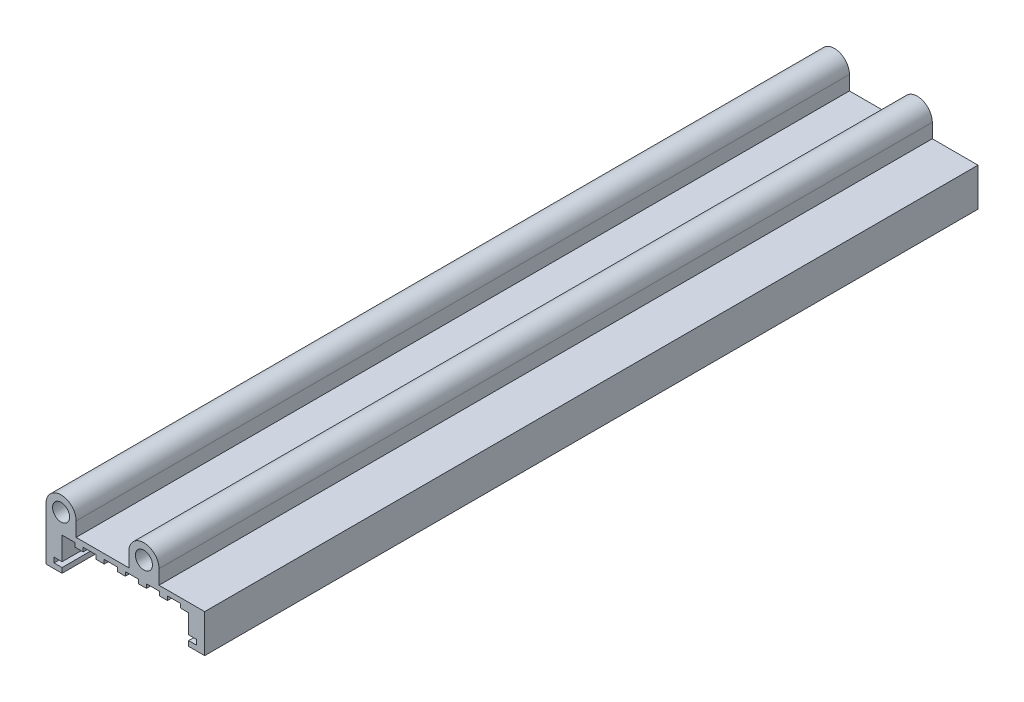
from build123d import *

# Parameters (mm, degrees)
SKETCH1_R           = 2.159
BOSS_EXTRUDE1_DEPTH = 195.58
SKETCH2_R           = 1.5875
CUT_EXTRUDE1_DEPTH  = 2.54


with BuildPart() as part:
    # Sketch1 → Boss-Extrude1 (new body)
    with BuildSketch(Plane.XY):
        with BuildLine():
            Line((0, 0), (-4.064, 0))
            Line((-4.064, 0), (-4.064, 9.652))
            Line((-4.064, 9.652), (-4.064, 13.2588))
            ThreePointArc((-4.064, 13.2588), (-0.254, 17.0688), (3.556, 13.2588))
            Line((3.556, 13.2588), (3.556, 9.652))
            Line((3.556, 9.652), (16.891, 9.652))
            Line((16.891, 9.652), (16.891, 13.2588))
            ThreePointArc((16.891, 13.2588), (20.701, 17.0688), (24.511, 13.2588))
            Line((24.511, 13.2588), (24.511, 9.652))
            Line((24.511, 9.652), (36.068, 9.652))
            Line((36.068, 9.652), (36.068, 0))
            Line((36.068, 0), (32.004, 0))
            Line((32.004, 0), (32.004, 1.27))
            Line((32.004, 1.27), (34.036, 1.27))
            Line((34.036, 1.27), (34.036, 2.54))
            Line((34.036, 2.54), (32.004, 2.54))
            Line((32.004, 2.54), (32.004, 7.366))
            Line((32.004, 7.366), (29.972, 7.366))
            Line((29.972, 7.366), (29.972, 8.382))
            Line((29.972, 8.382), (26.67, 8.382))
            Line((26.67, 8.382), (26.67, 7.366))
            Line((26.67, 7.366), (24.638, 7.366))
            Line((24.638, 7.366), (24.638, 8.382))
            Line((24.638, 8.382), (21.336, 8.382))
            Line((21.336, 8.382), (21.336, 7.366))
            Line((21.336, 7.366), (19.304, 7.366))
            Line((19.304, 7.366), (19.304, 8.382))
            Line((19.304, 8.382), (16.002, 8.382))
            Line((16.002, 8.382), (16.002, 7.366))
            Line((16.002, 7.366), (13.97, 7.366))
            Line((13.97, 7.366), (13.97, 8.382))
            Line((13.97, 8.382), (10.668, 8.382))
            Line((10.668, 8.382), (10.668, 7.366))
            Line((10.668, 7.366), (8.636, 7.366))
            Line((8.636, 7.366), (8.636, 8.382))
            Line((8.636, 8.382), (5.334, 8.382))
            Line((5.334, 8.382), (5.334, 7.366))
            Line((5.334, 7.366), (3.302, 7.366))
            Line((3.302, 7.366), (3.302, 8.382))
            Line((3.302, 8.382), (0, 8.382))
            Line((0, 8.382), (0, 2.54))
            Line((0, 2.54), (-2.032, 2.54))
            Line((-2.032, 2.54), (-2.032, 1.27))
            Line((-2.032, 1.27), (0, 1.27))
            Line((0, 1.27), (0, 0))
        make_face()
        with Locations((-0.254, 13.2588)):
            Circle(SKETCH1_R, mode=Mode.SUBTRACT)
        with Locations((20.701, 13.2588)):
            Circle(SKETCH1_R, mode=Mode.SUBTRACT)
    extrude(amount=-BOSS_EXTRUDE1_DEPTH)

    # Sketch2 → Cut-Extrude1 (cut)
    with BuildSketch(Plane.ZY.offset(4.064)):
        with Locations((-33.02, 6.6294)):
            Circle(SKETCH2_R)
        with Locations((-50.8, 6.6294)):
            Circle(SKETCH2_R)
    extrude(amount=-CUT_EXTRUDE1_DEPTH, mode=Mode.SUBTRACT)


solid = part.part
